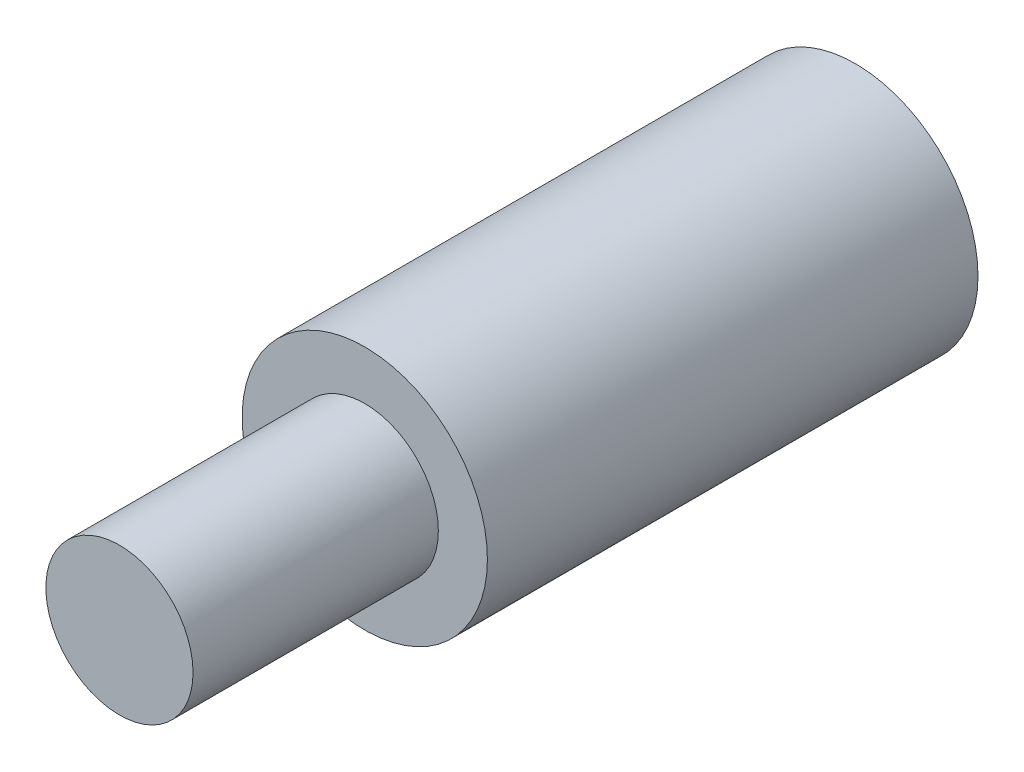
from build123d import *

# Parameters (mm, degrees)
SKETCH1_R           = 2.5
BOSS_EXTRUDE1_DEPTH = 10
SKETCH2_R           = 1.5
BOSS_EXTRUDE2_DEPTH = 5
SKETCH3_R           = 1.5
CUT_EXTRUDE1_DEPTH  = 5


with BuildPart() as part:
    # Sketch1 → Boss-Extrude1 (new body)
    with BuildSketch(Plane.XY):
        Circle(SKETCH1_R)
    extrude(amount=BOSS_EXTRUDE1_DEPTH)

    # Sketch2 → Boss-Extrude2 (add)
    with BuildSketch(Plane.XY.offset(10)):
        Circle(SKETCH2_R)
    extrude(amount=BOSS_EXTRUDE2_DEPTH)

    # Sketch3 → Cut-Extrude1 (cut)
    with BuildSketch(Plane(origin=(0, 0, 0), x_dir=(-1, 0, 0), z_dir=(0, 0, -1))):
        with Locations(Location((0, 0, 0), (0, 0, 180))):
            Circle(SKETCH3_R)
    extrude(amount=-CUT_EXTRUDE1_DEPTH, mode=Mode.SUBTRACT)


solid = part.part
